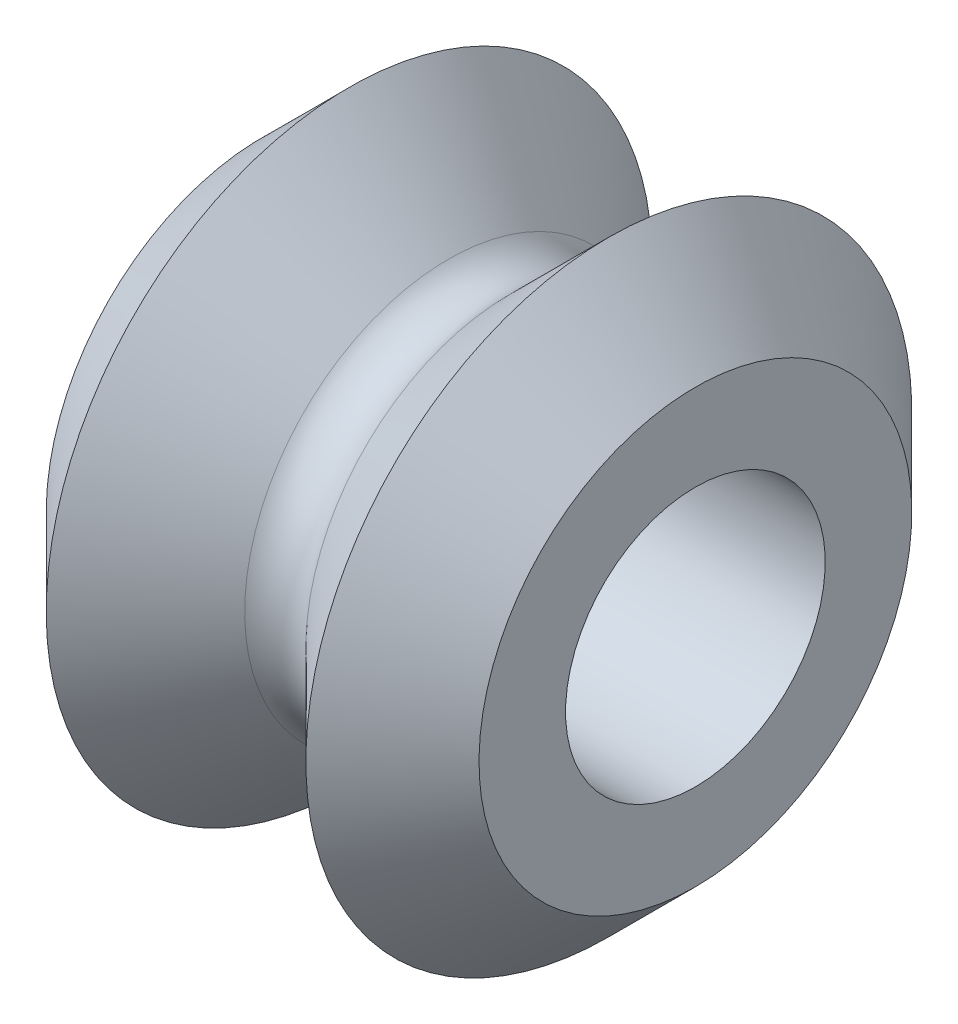
from build123d import *

# Parameters (mm, degrees)
FILLET1_R          = 1
SKETCH2_R          = 3
CUT_EXTRUDE1_DEPTH = 15.071247379


with BuildPart() as part:
    # Sketch1 → Revolve1 (revolve)
    with BuildSketch(Plane.XY, mode=Mode.PRIVATE) as revolve1_sk:
        Polygon((5, 0), (5, 5), (3, 7), (0, 4), (-3, 7), (-5, 5), (-5, 0), align=None)
    revolve(revolve1_sk.sketch.rotate(Axis((-5, 0, 0), (1, 0, 0)), 180), axis=Axis((-5, 0, 0), (1, 0, 0)))

    # Fillet1
    fillet1_edges = [part.edges().sort_by_distance(p)[0] for p in [
        (0, 4, 0),
    ]]
    fillet(fillet1_edges, radius=FILLET1_R)

    # Sketch2 → Cut-Extrude1 (cut, through all)
    with BuildSketch(Plane(origin=(5, 0, 0), x_dir=(0, 0, -1), z_dir=(1, 0, 0))):
        with Locations(Location((0, 0, 0), (0, 0, 90))):
            Circle(SKETCH2_R)
    extrude(amount=-CUT_EXTRUDE1_DEPTH, mode=Mode.SUBTRACT)


solid = part.part
